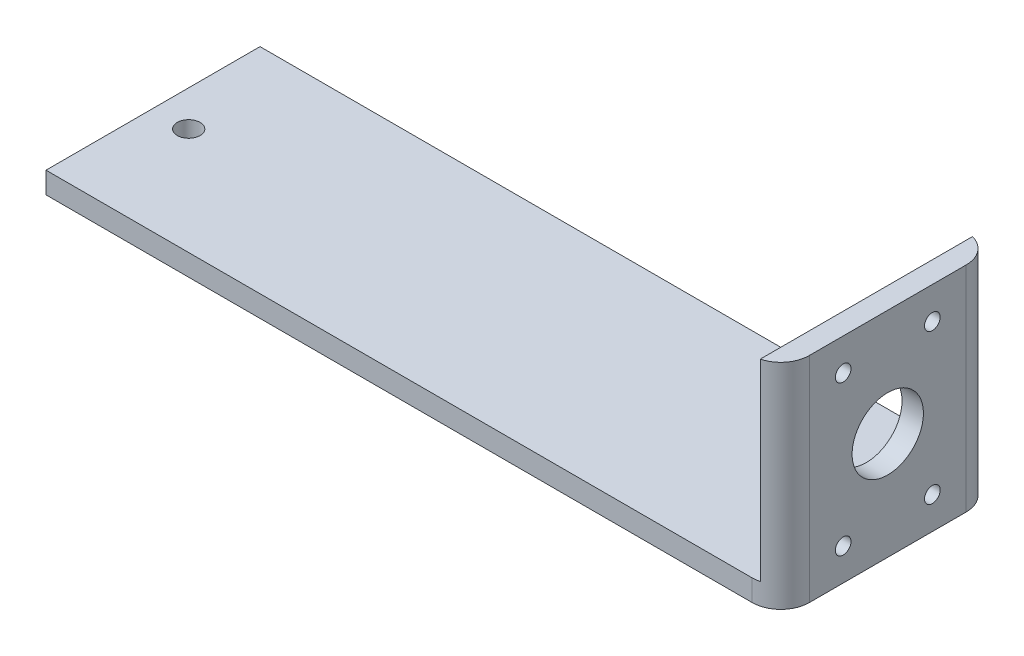
from build123d import *

# Parameters (mm, degrees)
SKETCH1_W           = 100
SKETCH1_H           = 30
BOSS_EXTRUDE1_DEPTH = 3
SKETCH2_R           = 1.6
CUT_EXTRUDE1_DEPTH  = 53.28766585
SKETCH5_W           = 30
SKETCH5_H           = 30
BOSS_EXTRUDE2_DEPTH = 3
SKETCH6_R           = 1.1
CUT_EXTRUDE2_DEPTH  = 109.323589305
SKETCH7_R           = 5
CUT_EXTRUDE3_DEPTH  = 109.323589305
FILLET1_R           = 4


with BuildPart() as part:
    # Sketch1 → Boss-Extrude1 (new body)
    with BuildSketch(Plane(origin=(0, 0, 0), x_dir=(1, 0, 0), z_dir=(0, 1, 0))):
        Rectangle(SKETCH1_W, SKETCH1_H)
    extrude(amount=BOSS_EXTRUDE1_DEPTH)

    # Sketch2 → Cut-Extrude1 (cut, through all)
    with BuildSketch(Plane(origin=(0, 3, 0), x_dir=(1, 0, 0), z_dir=(0, 1, 0))):
        with Locations(Location((45, 0, 0), (0, 0, 270))):
            Circle(SKETCH2_R)
        with Locations(Location((-45, 0, 0), (0, 0, 90))):
            Circle(SKETCH2_R)
    extrude(amount=-CUT_EXTRUDE1_DEPTH, mode=Mode.SUBTRACT)

    # Sketch5 → Boss-Extrude2 (add)
    with BuildSketch(Plane(origin=(50, 0, 0), x_dir=(0, 0, -1), z_dir=(1, 0, 0))):
        with Locations((0, 15)):
            Rectangle(SKETCH5_W, SKETCH5_H)
    extrude(amount=BOSS_EXTRUDE2_DEPTH)

    # Sketch6 → Cut-Extrude2 (cut, through all)
    with BuildSketch(Plane(origin=(53, 0, 0), x_dir=(0, 0, -1), z_dir=(1, 0, 0))):
        with Locations((-6.25, 25.5)):
            Circle(SKETCH6_R)
        with Locations(Location((6.25, 25.5, 0), (0, 0, 180))):
            Circle(SKETCH6_R)
        with Locations((6.25, 4.5)):
            Circle(SKETCH6_R)
        with Locations(Location((-6.25, 4.5, 0), (0, 0, 180))):
            Circle(SKETCH6_R)
    extrude(amount=-CUT_EXTRUDE2_DEPTH, mode=Mode.SUBTRACT)

    # Sketch7 → Cut-Extrude3 (cut, through all)
    with BuildSketch(Plane(origin=(53, 0, 0), x_dir=(0, 0, -1), z_dir=(1, 0, 0))):
        with Locations((0, 15)):
            Circle(SKETCH7_R)
    extrude(amount=-CUT_EXTRUDE3_DEPTH, mode=Mode.SUBTRACT)

    # Fillet1
    fillet1_edges = [part.edges().sort_by_distance(p)[0] for p in [
        (53, 15, -15),
        (53, 15, 15),
    ]]
    fillet(fillet1_edges, radius=FILLET1_R)


solid = part.part
